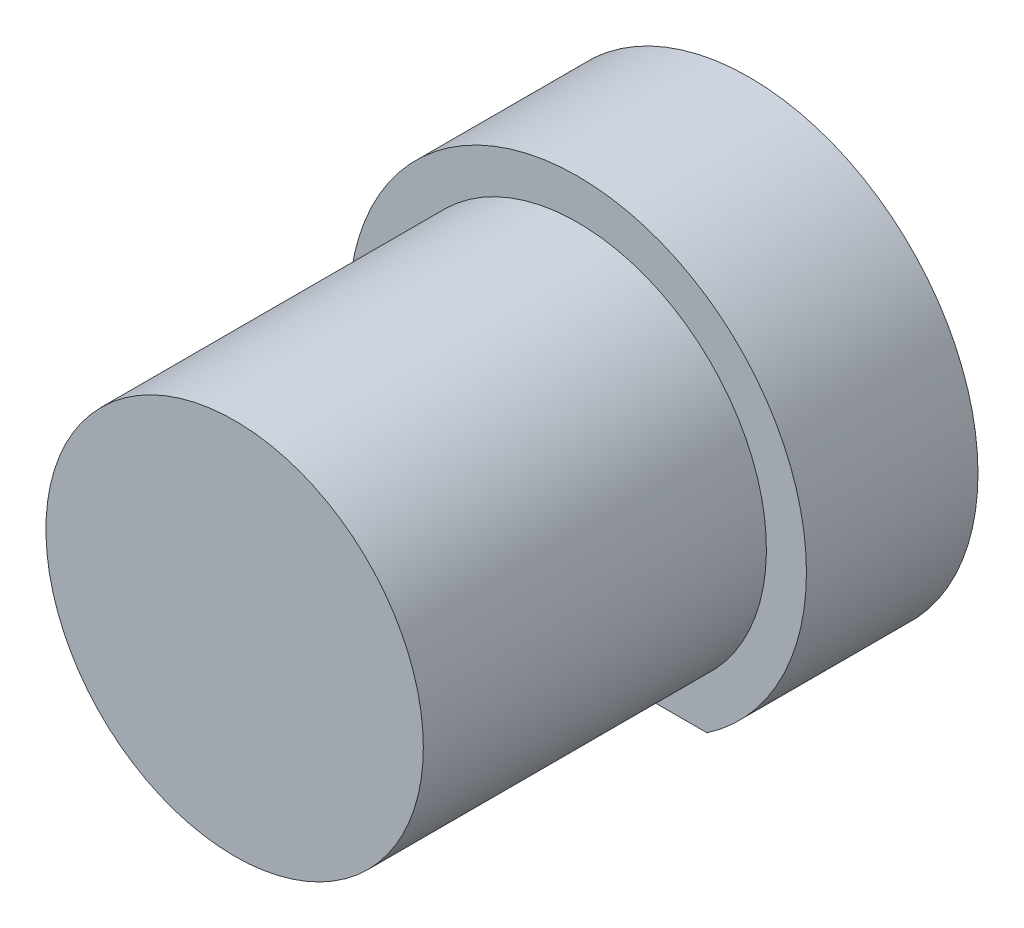
from build123d import *

# Parameters (mm, degrees)
SKETCH1_R           = 2
BOSS_EXTRUDE1_DEPTH = 1.5
SKETCH2_R           = 1.65
BOSS_EXTRUDE2_DEPTH = 3
CUT_EXTRUDE1_START  = -1.5
CUT_EXTRUDE1_DEPTH  = 1.5


with BuildPart() as part:
    # Sketch1 → Boss-Extrude1 (new body)
    with BuildSketch(Plane.XY):
        Circle(SKETCH1_R)
    extrude(amount=BOSS_EXTRUDE1_DEPTH)

    # Sketch2 → Boss-Extrude2 (add)
    with BuildSketch(Plane.XY.offset(1.5)):
        Circle(SKETCH2_R)
    extrude(amount=BOSS_EXTRUDE2_DEPTH)

    # Sketch3 → Cut-Extrude1 (cut)
    with BuildSketch(Plane.XY.offset(1.5).offset(CUT_EXTRUDE1_START)):
        with BuildLine():
            Line((-1.130265456, -1.65), (1.130265456, -1.65))
            ThreePointArc((1.130265456, -1.65), (0, -2), (-1.130265456, -1.65))
        make_face()
    extrude(amount=CUT_EXTRUDE1_DEPTH, mode=Mode.SUBTRACT)


solid = part.part
